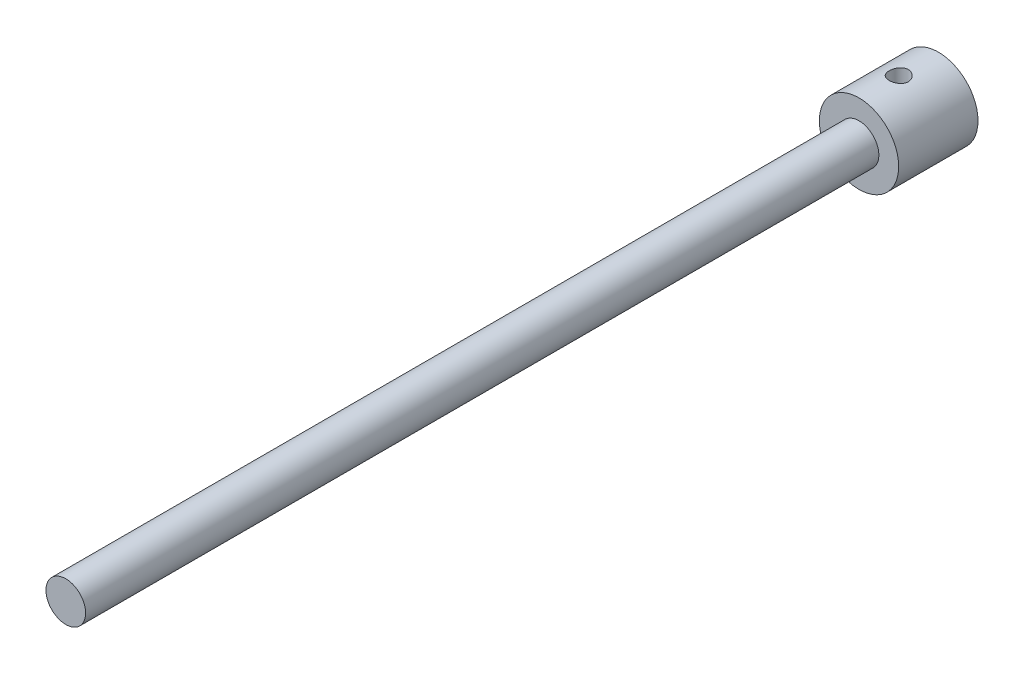
from build123d import *

# Parameters (mm, degrees)
SKETCH1_R               = 25
BOSS_EXTRUDE1_DEPTH     = 50
SKETCH1_3_R             = 12.5
BOSS_EXTRUDE2_DEPTH     = 550
CUT_EXTRUDE1_DEPTH      = 552.135192126
CUT_EXTRUDE1_DEPTH_BACK = 552.135192126
SKETCH2_R               = 6


with BuildPart() as part:
    # Sketch1 → Boss-Extrude1 (new body)
    with BuildSketch(Plane.XY):
        Circle(SKETCH1_R)
    extrude(amount=BOSS_EXTRUDE1_DEPTH)

    # Sketch1<3> → Boss-Extrude2 (add)
    with BuildSketch(Plane.XY):
        Circle(SKETCH1_3_R)
    extrude(amount=BOSS_EXTRUDE2_DEPTH)

    # Sketch2 → Cut-Extrude1 (cut, two sides: drawn at the far end of the back side and taken through both)
    with BuildSketch(Plane(origin=(0, 0, 0), x_dir=(1, 0, 0), z_dir=(0, 1, 0)).offset(-CUT_EXTRUDE1_DEPTH_BACK)):
        with Locations((0, -25)):
            Circle(SKETCH2_R)
    extrude(amount=CUT_EXTRUDE1_DEPTH + CUT_EXTRUDE1_DEPTH_BACK, mode=Mode.SUBTRACT)


solid = part.part
